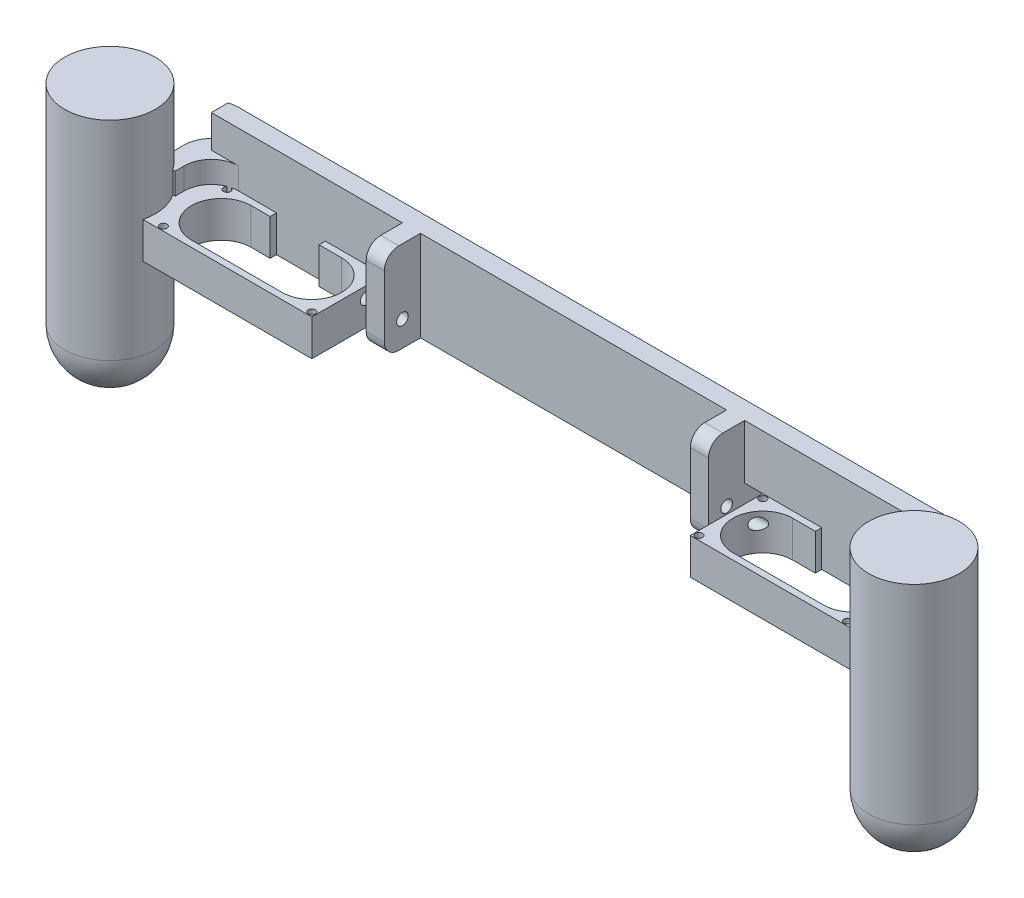
from build123d import *

# Parameters (mm, degrees)
EXTRUDE_1_DEPTH      = 5
SKETCH_2_W           = 5
SKETCH_2_H           = 25
EXTRUDE_2_DEPTH      = 10
SKETCH_3_R           = 1.5
CUT_EXTRUDE_1_DEPTH  = 120
FILLET_1_R           = 4
SKETCH_4_W           = 5
SKETCH_4_H           = 16
EXTRUDE_3_DEPTH      = 15
FILLET_3_R           = 7.5
EXTRUDE_4_DEPTH      = 10
EXTRUDE_4_DEPTH_BACK = 60
SKETCH_5_R           = 12.5
FILLET_4_R           = 12.5
SKETCH_6_R           = 1
EXTRUDE_5_DEPTH      = 10
SKETCH_7_R           = 1.6
CUT_EXTRUDE_2_DEPTH  = 40
CUT_EXTRUDE_START    = -40
SKETCH_8_R           = 1.6
CUT_EXTRUDE_3_DEPTH  = 40


with BuildPart() as part:
    # 草图1 → 凸台-拉伸1 (new body)
    with BuildSketch(Plane.XY):
        Polygon((-45.482044199, 8.198895028), (49.017955801, 8.198895028), (49.017955801, 18.198895028), (54.017955801, 18.198895028), (54.017955801, 8.198895028), (101.767955801, 8.198895028), (101.767955801, 33.198895028), (-98.232044199, 33.198895028), (-98.232044199, 8.198895028), (-50.482044199, 8.198895028), (-50.482044199, 18.198895028), (-45.482044199, 18.198895028), align=None)
    extrude(amount=EXTRUDE_1_DEPTH)

    # 草图2 → 凸台-拉伸2 (add)
    with BuildSketch(Plane.XY.offset(5)):
        with Locations((-42.982044199, 20.698895028)):
            Rectangle(SKETCH_2_W, SKETCH_2_H)
        with Locations((46.517955801, 20.698895028)):
            Rectangle(SKETCH_2_W, SKETCH_2_H)
    extrude(amount=EXTRUDE_2_DEPTH)

    # 草图3 → 切除-拉伸1 (cut)
    with BuildSketch(Plane(origin=(49.017955801, 0, 0), x_dir=(0, 0, -1), z_dir=(1, 0, 0))):
        with Locations((-10, 15.198895028)):
            Circle(SKETCH_3_R)
    extrude(amount=-CUT_EXTRUDE_1_DEPTH, mode=Mode.SUBTRACT)

    # 圆角1
    fillet_1_edges = [part.edges().sort_by_distance(p)[0] for p in [
        (-42.982044199, 8.198895028, 15),
        (-42.982044199, 33.198895028, 15),
        (46.517955801, 33.198895028, 15),
        (46.517955801, 8.198895028, 15),
    ]]
    fillet(fillet_1_edges, radius=FILLET_1_R)

    # 草图4 → 凸台-拉伸3 (add)
    with BuildSketch(Plane(origin=(0, 0, 0), x_dir=(-1, 0, 0), z_dir=(0, 0, -1))):
        with Locations((-104.267955801, 16.198895028)):
            Rectangle(SKETCH_4_W, SKETCH_4_H)
        with Locations((100.732044199, 16.198895028)):
            Rectangle(SKETCH_4_W, SKETCH_4_H)
    extrude(amount=-EXTRUDE_3_DEPTH)

    # 圆角3
    fillet_3_edges = [part.edges().sort_by_distance(p)[0] for p in [
        (-98.232044199, 16.198895028, 5),
        (-103.232044199, 16.198895028, 0),
        (101.767955801, 16.198895028, 5),
        (106.767955801, 16.198895028, 0),
    ]]
    fillet(fillet_3_edges, radius=FILLET_3_R)

    # 草图5 → 凸台-拉伸4 (add, two sides: drawn at the far end of the back side and taken through both)
    with BuildSketch(Plane(origin=(0, 33.198895028, 0), x_dir=(1, 0, 0), z_dir=(0, 1, 0)).offset(-EXTRUDE_4_DEPTH_BACK)):
        with Locations(Location((-109.232044199, -22, 0), (0, 0, 270))):
            Circle(SKETCH_5_R)
        with Locations(Location((112.767955801, -22, 0), (0, 0, 270))):
            Circle(SKETCH_5_R)
    extrude(amount=EXTRUDE_4_DEPTH + EXTRUDE_4_DEPTH_BACK)

    # 圆角4
    fillet_4_edges = [part.edges().sort_by_distance(p)[0] for p in [
        (-109.232044199, -26.801104972, 9.5),
        (112.767955801, -26.801104972, 9.5),
    ]]
    fillet(fillet_4_edges, radius=FILLET_4_R)

    # 草图6 → 凸台-拉伸5 (add)
    # profile 1 of 2: a face of its own
    with BuildSketch(Plane.XZ.offset(-8.198895028)):
        with BuildLine():
            ThreePointArc((89.017955801, 23.25), (97.267955801, 15), (89.017955801, 6.75))
            Line((89.017955801, 6.75), (83.802055385, 6.75))
            Line((83.802055385, 6.75), (83.802055385, 5))
            Line((83.802055385, 5), (104.017955801, 5))
            Line((104.017955801, 5), (104.017955801, 25))
            Line((104.017955801, 25), (54.017955801, 25))
            Line((54.017955801, 25), (54.017955801, 5))
            Line((54.017955801, 5), (70.296008778, 5))
            Line((70.296008778, 5), (70.296008778, 6.75))
            Line((70.296008778, 6.75), (64.017955801, 6.75))
            ThreePointArc((64.017955801, 6.75), (55.767955801, 15), (64.017955801, 23.25))
            Line((64.017955801, 23.25), (89.017955801, 23.25))
        make_face()
        with Locations(Location((55.217955801, 6.2, 0), (0, 0, 270))):
            Circle(SKETCH_6_R, mode=Mode.SUBTRACT)
        with Locations((96.217955801, 6.2)):
            Circle(SKETCH_6_R, mode=Mode.SUBTRACT)
        with Locations(Location((55.217955801, 23.8, 0), (0, 0, 270))):
            Circle(SKETCH_6_R, mode=Mode.SUBTRACT)
        with Locations(Location((96.217955801, 23.8, 0), (0, 0, 270))):
            Circle(SKETCH_6_R, mode=Mode.SUBTRACT)
    # profile 2 of 2: a face of its own
    with BuildSketch(Plane.XZ.offset(-8.198895028)):
        with BuildLine():
            Line((-66.760097176, 6.75), (-66.760097176, 5))
            Line((-66.760097176, 5), (-50.482044199, 5))
            Line((-50.482044199, 5), (-50.482044199, 25))
            Line((-50.482044199, 25), (-100.482044199, 25))
            Line((-100.482044199, 25), (-100.482044199, 5))
            Line((-100.482044199, 5), (-80.266143783, 5))
            Line((-80.266143783, 5), (-80.266143783, 6.75))
            Line((-80.266143783, 6.75), (-85.482044199, 6.75))
            ThreePointArc((-85.482044199, 6.75), (-93.732044199, 15), (-85.482044199, 23.25))
            Line((-85.482044199, 23.25), (-60.482044199, 23.25))
            ThreePointArc((-60.482044199, 23.25), (-52.232044199, 15), (-60.482044199, 6.75))
            Line((-60.482044199, 6.75), (-66.760097176, 6.75))
        make_face()
        with Locations((-92.682044199, 6.2)):
            Circle(SKETCH_6_R, mode=Mode.SUBTRACT)
        with Locations(Location((-51.682044199, 6.2, 0), (0, 0, 270))):
            Circle(SKETCH_6_R, mode=Mode.SUBTRACT)
        with Locations(Location((-92.682044199, 23.8, 0), (0, 0, 270))):
            Circle(SKETCH_6_R, mode=Mode.SUBTRACT)
        with Locations(Location((-51.682044199, 23.8, 0), (0, 0, 270))):
            Circle(SKETCH_6_R, mode=Mode.SUBTRACT)
    extrude(amount=-EXTRUDE_5_DEPTH)

    # 草图7 → 切除-拉伸2 (cut)
    with BuildSketch(Plane(origin=(-40.482044199, 0, 0), x_dir=(0, 0, -1), z_dir=(1, 0, 0))):
        with Locations((-10, 15.198895028)):
            Circle(SKETCH_7_R)
    extrude(amount=-CUT_EXTRUDE_2_DEPTH, mode=Mode.SUBTRACT)

    # 草图8 → 切除-拉伸3 (cut)
    with BuildSketch(Plane.ZY.offset(-44.017955801).offset(CUT_EXTRUDE_START)):
        with Locations(Location((10, 15.198895028, 0), (0, 0, 180))):
            Circle(SKETCH_8_R)
    extrude(amount=CUT_EXTRUDE_3_DEPTH, mode=Mode.SUBTRACT)


solid = part.part
